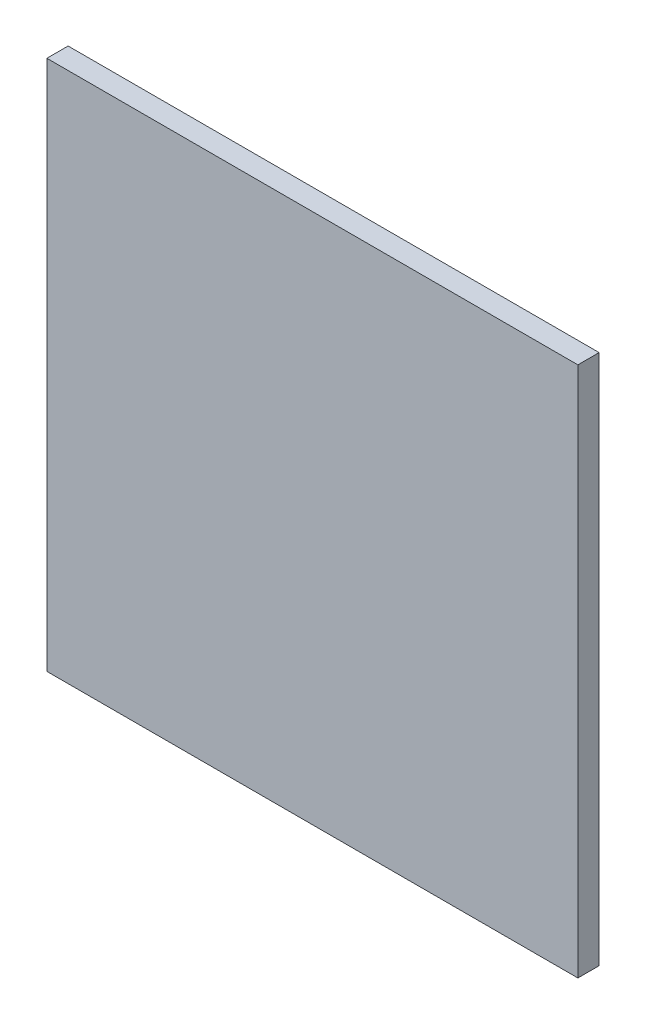
from build123d import *

# Parameters (mm, degrees)
SKETCH1_W           = 75
SKETCH1_H           = 75
BOSS_EXTRUDE1_DEPTH = 3


with BuildPart() as part:
    # Sketch1 → Boss-Extrude1 (new body)
    with BuildSketch(Plane.XY):
        Rectangle(SKETCH1_W, SKETCH1_H)
    extrude(amount=BOSS_EXTRUDE1_DEPTH)


solid = part.part
